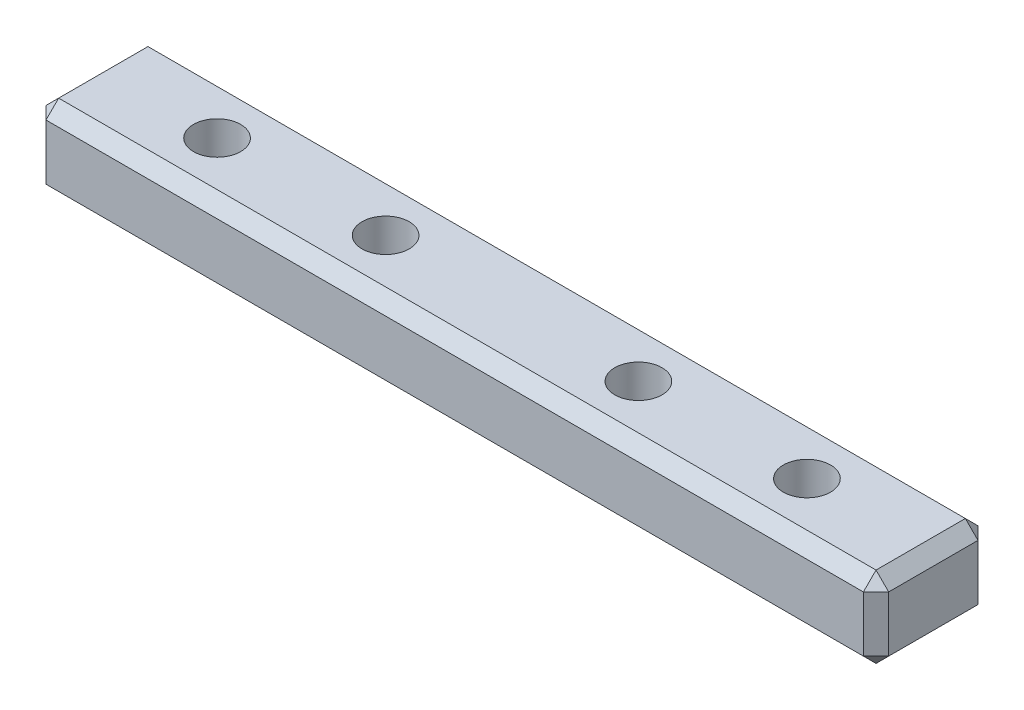
from build123d import *

# Parameters (mm, degrees)
SCHIZZO1_W                   = 100
SCHIZZO1_H                   = 13.6
ESTRUSIONE_ESTRUSIONE1_DEPTH = 9.6
FORO_5_6_5_6_1_D             = 5.6
SMUSSO1_SIZE                 = 1.5


with BuildPart() as part:
    # Schizzo1 → Estrusione-Estrusione1 (new body)
    with BuildSketch(Plane(origin=(0, 4.8, 0), x_dir=(1, 0, 0), z_dir=(0, 1, 0))):
        Rectangle(SCHIZZO1_W, SCHIZZO1_H)
    extrude(amount=-ESTRUSIONE_ESTRUSIONE1_DEPTH)

    # Foro Ø5.6 (5.6)-1 (through all)
    with Locations(Plane(origin=(0, -4.8, 0), x_dir=(-1, 0, 0), z_dir=(0, -1, 0))):
        with Locations((-35, 0), (35, 0), (-15, 0), (15, 0)):
            Hole(FORO_5_6_5_6_1_D / 2)

    # Smusso1
    smusso1_edges = [part.edges().sort_by_distance(p)[0] for p in [
        (0, -4.8, -6.8),
        (-50, -4.8, 0),
        (0, -4.8, 6.8),
        (-50, 4.8, 0),
        (0, 4.8, -6.8),
        (50, 4.8, 0),
        (0, 4.8, 6.8),
        (-50, 0, 6.8),
        (-50, 0, -6.8),
        (50, 0, -6.8),
        (50, 0, 6.8),
        (50, -4.8, 0),
    ]]
    chamfer(smusso1_edges, length=SMUSSO1_SIZE)


solid = part.part
